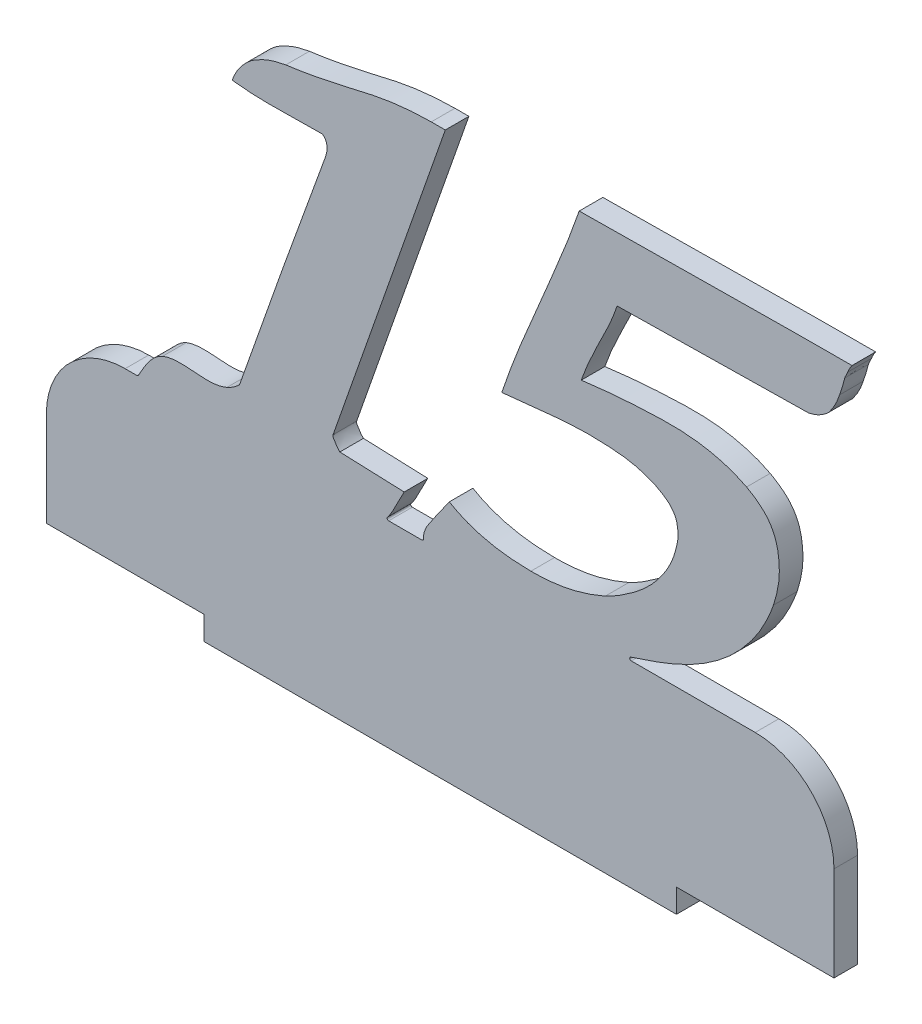
from build123d import *

# Parameters (mm, degrees)
BOSS_EXTRUDE1_DEPTH = 3
FILLET1_R           = 10
FILLET2_R           = 0.2


with BuildPart() as part:
    # Sketch1 → Boss-Extrude1 (new body)
    with BuildSketch(Plane.XY):
        with BuildLine():
            Line((42.946758523, 22.000000982), (47.898151986, 22.000000982))
            add(Edge.make_bspline(
                [(47.898151986, 22.000000982), (47.883490051, 22.095223457), (47.846153523, 22.530955992), (48.045508283, 23.389711399), (48.672574146, 24.428109156), (49.410721279, 25.442981061), (50.219861981, 26.635588093), (50.812883759, 27.435987917), (51.157567946, 27.936274782)],
                knots=[0.184195693, 0.184195693, 0.184195693, 0.184195693, 0.218197342, 0.338418704, 0.48851169, 0.646371825, 0.784334397, 1, 1, 1, 1], degree=3))
            add(Edge.make_bspline(
                [(51.157567946, 27.936274782), (52.605224049, 27.077959376), (56.001660696, 25.801978147), (59.611363338, 25.506881485), (61.517223927, 25.492959692)],
                knots=[0, 0, 0, 0, 0.467740759, 1, 1, 1, 1], degree=3))
            add(Edge.make_bspline(
                [(61.517223927, 25.492959692), (63.162301418, 25.487124771), (66.410639497, 25.786448399), (69.502388601, 26.82252922), (70.958193435, 27.467158285)],
                knots=[0, 0, 0, 0, 0.508188984, 1, 1, 1, 1], degree=3))
            add(Edge.make_bspline(
                [(70.958193435, 27.467158285), (72.039242849, 27.989067677), (73.536041672, 28.899518446), (75.358411374, 30.269691604), (76.524834073, 31.33555541), (77.53591489, 32.465082249), (78.676774253, 34.020246782), (79.353941274, 35.287800026), (79.656395155, 36.184906526)],
                knots=[0, 0, 0, 0, 0.285166795, 0.415663546, 0.541808395, 0.660345555, 0.775657586, 1, 1, 1, 1], degree=3))
            add(Edge.make_bspline(
                [(79.656395155, 36.184906526), (79.849476223, 36.813636227), (80.134305645, 37.72336347), (80.231120864, 38.929751352), (80.139612921, 39.710530152), (79.986052437, 40.424380369), (79.649610957, 41.046817747), (79.220443153, 41.604554094), (78.457990033, 42.229675171), (77.341611618, 42.884927188), (75.815265509, 43.456085196), (74.11454099, 43.903979405), (71.571270185, 44.167227834), (68.20522264, 44.295813185), (64.82012621, 44.036146098), (62.215136031, 43.736601574), (60.12375798, 43.518798423), (58.68848093, 43.395025356), (57.822931511, 43.299840067)],
                knots=[0, 0, 0, 0, 0.071404243, 0.102517896, 0.130176365, 0.156355673, 0.180967082, 0.206088886, 0.232106092, 0.287156962, 0.345457123, 0.40808307, 0.477037327, 0.621747178, 0.772340906, 0.844016801, 0.905722023, 1, 1, 1, 1], degree=3))
            add(Edge.make_bspline(
                [(57.822931511, 43.299840067), (59.231372317, 47.514452777), (62.688059672, 55.732557284), (66.209073869, 63.922644583), (67.654831433, 68.163014422)],
                knots=[0, 0, 0, 0, 0.497975483, 1, 1, 1, 1], degree=3))
            add(Edge.make_bspline(
                [(67.654831433, 68.163014422), (73.414514779, 68.231339138), (84.959935232, 68.349235223), (96.505057231, 68.505338323), (102.291266148, 68.495305275)],
                knots=[0, 0, 0, 0, 0.498878118, 1, 1, 1, 1], degree=3))
            add(Edge.make_bspline(
                [(102.291266148, 68.495305275), (101.965653373, 68.04000855), (101.763510088, 67.517979239)],
                knots=[0, 0, 0, 1, 1, 1], degree=2))
            add(Edge.make_bspline(
                [(101.763510088, 67.517979239), (101.645471357, 67.282606362), (101.531823493, 67.009447526), (101.3689793, 66.72071669), (101.372579674, 66.657932327)],
                knots=[0, 0, 0, 0, 0.803037268, 1, 1, 1, 1], degree=3))
            add(Edge.make_bspline(
                [(101.372579674, 66.657932327), (101.232746812, 66.191725954), (101.06308725, 65.446166087), (100.80847573, 64.725905783), (100.707997969, 64.468722006)],
                knots=[0, 0, 0, 0, 0.638073184, 1, 1, 1, 1], degree=3))
            add(Edge.make_bspline(
                [(100.707997969, 64.468722006), (100.274578031, 63.065409905), (99.378834561, 61.908127792)],
                knots=[0, 0, 0, 1, 1, 1], degree=2))
            add(Edge.make_bspline(
                [(99.378834561, 61.908127792), (98.308082116, 60.842059769), (96.818240346, 60.520324821)],
                knots=[0, 0, 0, 1, 1, 1], degree=2))
            Line((96.818240346, 60.520324821), (72.46327553, 60.129394407))
            add(Edge.make_bspline(
                [(72.46327553, 60.129394407), (71.881895848, 58.294101053), (70.142525795, 54.913763281), (68.517024247, 51.479010125), (67.908936202, 49.691552343)],
                knots=[0, 0, 0, 0, 0.504222707, 1, 1, 1, 1], degree=3))
            add(Edge.make_bspline(
                [(67.908936202, 49.691552343), (69.590342505, 49.92258628), (72.189386238, 50.179598568), (75.764651805, 50.41091275), (78.612597667, 50.517861575), (81.454228075, 50.477894991), (84.956908335, 49.987878732), (87.425626358, 49.224619702), (88.901899455, 48.440575017)],
                knots=[0, 0, 0, 0, 0.238617441, 0.367154901, 0.503750525, 0.639402589, 0.766127973, 1, 1, 1, 1], degree=3))
            add(Edge.make_bspline(
                [(88.901899455, 48.440575017), (89.88882817, 47.892532076), (91.298694559, 46.918071943), (92.445423533, 45.039013899), (92.897386812, 43.536568687), (93.0778099, 41.970084183), (93.063867817, 39.807347988), (92.658816901, 38.207402989), (92.322540581, 37.162232562)],
                knots=[0, 0, 0, 0, 0.263830967, 0.382076604, 0.502053545, 0.623420155, 0.745364216, 1, 1, 1, 1], degree=3))
            add(Edge.make_bspline(
                [(92.322540581, 37.162232562), (91.770218966, 35.617368804), (90.711097006, 33.375318743), (88.712129759, 30.779352355), (87.021026548, 28.969869892), (85.055024895, 27.355607457), (82.848872509, 25.899168033), (80.395384063, 24.629761015), (77.740448901, 23.573210326), (75.228205369, 22.704006157), (73.610023361, 22.202921002), (72.918022703, 22.000000982)],
                knots=[0, 0, 0, 0, 0.120139222, 0.179293704, 0.238927503, 0.300823558, 0.364758517, 0.431861411, 0.502352241, 0.573447082, 0.626158368, 0.626158368, 0.626158368, 0.626158368], degree=3))
            Line((72.918022703, 22.000000982), (90.110220598, 22.000000982))
            Line((90.110220598, 22.000000982), (100, 22.000000982))
            Line((100, 22.000000982), (100, 0))
            Line((100, 0), (80, 0))
            Line((80, 0), (80, -3))
            Line((80, -3), (20, -3))
            Line((20, -3), (20, 0))
            Line((20, 0), (0, 0))
            Line((0, 0), (0, 22.000000982))
            Line((0, 22.000000982), (11.616267236, 22.000000982))
            add(Edge.make_bspline(
                [(11.616267236, 22.000000982), (11.695067664, 22.134280364), (12.020627957, 22.702233574), (12.826552185, 24.14797613), (13.82117152, 25.317586941), (14.761946367, 25.747064462)],
                knots=[0.170914532, 0.170914532, 0.170914532, 0.170914532, 0.24891213, 0.498932816, 1, 1, 1, 1], degree=3))
            add(Edge.make_bspline(
                [(14.761946367, 25.747064462), (16.103314661, 26.266328472), (18.854052425, 25.991560412), (21.623385848, 25.835912313), (22.932392027, 26.411646166)],
                knots=[0, 0, 0, 0, 0.501451854, 1, 1, 1, 1], degree=3))
            add(Edge.make_bspline(
                [(22.932392027, 26.411646166), (23.813934964, 26.802158719), (24.515660206, 27.467158285)],
                knots=[0, 0, 0, 1, 1, 1], degree=2))
            add(Edge.make_bspline(
                [(24.515660206, 27.467158285), (26.297956084, 32.502331285), (29.822953287, 42.62513254), (33.51198128, 52.689329292), (35.344432684, 57.744718879)],
                knots=[0, 0, 0, 0, 0.498322561, 1, 1, 1, 1], degree=3))
            add(Edge.make_bspline(
                [(35.344432684, 57.744718879), (35.52760975, 58.242257092), (35.822795877, 59.208832866), (35.370202105, 60.120228338), (35.012141832, 60.324859614)],
                knots=[0, 0, 0, 0, 0.581397084, 1, 1, 1, 1], degree=3))
            add(Edge.make_bspline(
                [(35.012141832, 60.324859614), (33.095420949, 60.358656686), (29.290430069, 60.174748283), (25.477448351, 60.27948516), (23.596973732, 60.520324821)],
                knots=[0, 0, 0, 0, 0.503014916, 1, 1, 1, 1], degree=3))
            add(Edge.make_bspline(
                [(23.596973732, 60.520324821), (23.828936241, 61.187497316), (24.313179851, 62.136451351), (25.231173967, 63.197187523), (26.004457708, 63.91971256), (26.952419401, 64.47342115), (28.379437411, 65.156120772), (29.571495091, 65.470937646), (30.399162942, 65.602420208)],
                knots=[0, 0, 0, 0, 0.237267367, 0.352023708, 0.469658656, 0.590380818, 0.718477308, 1, 1, 1, 1], degree=3))
            add(Edge.make_bspline(
                [(30.399162942, 65.602420208), (33.511428968, 66.000857352), (37.373196561, 66.852861309), (41.994996116, 67.932675514), (45.07489721, 68.415151259), (47.367988503, 68.562701698), (48.870625022, 68.573491358)],
                knots=[0, 0, 0, 0, 0.501477793, 0.632810111, 0.759518477, 1, 1, 1, 1], degree=3))
            add(Edge.make_bspline(
                [(48.870625022, 68.573491358), (49.079121243, 68.573491358), (49.672032371, 68.573491358), (50.2649435, 68.573491358), (50.649358407, 68.573491358)],
                knots=[0, 0, 0, 0, 0.351648352, 1, 1, 1, 1], degree=3))
            Line((50.649358407, 68.573491358), (36.399944803, 27.936274782))
            add(Edge.make_bspline(
                [(36.399944803, 27.936274782), (36.346762148, 27.736478287), (36.678401883, 27.226785228), (36.956092231, 26.744002354), (37.259991715, 26.470285728)],
                knots=[0, 0, 0, 0, 0.324502414, 1, 1, 1, 1], degree=3))
            Line((37.259991715, 26.470285728), (45.430437375, 26.157541397))
            add(Edge.make_bspline(
                [(45.430437375, 26.157541397), (44.835497811, 25.144322271), (44.290337701, 23.822082893), (43.434459218, 22.424623169), (43.095678849, 22.116349753), (42.946758523, 22.000000982)],
                knots=[0, 0, 0, 0, 0.504343167, 0.619768133, 0.7008898, 0.7008898, 0.7008898, 0.7008898], degree=3))
        make_face()
    extrude(amount=BOSS_EXTRUDE1_DEPTH)

    # Fillet1
    fillet1_edges = [part.edges().sort_by_distance(p)[0] for p in [
        (100, 22.000000982, 1.5),
        (0, 22.000000982, 1.5),
    ]]
    fillet(fillet1_edges, radius=FILLET1_R)

    # Fillet2
    fillet2_edges = [part.edges().sort_by_distance(p)[0] for p in [
        (72.918022703, 22.000000982, 1.5),
        (42.946758523, 22.000000982, 1.5),
        (47.898151986, 22.000000982, 1.5),
        (11.616267236, 22.000000982, 1.5),
    ]]
    fillet(fillet2_edges, radius=FILLET2_R)


solid = part.part
